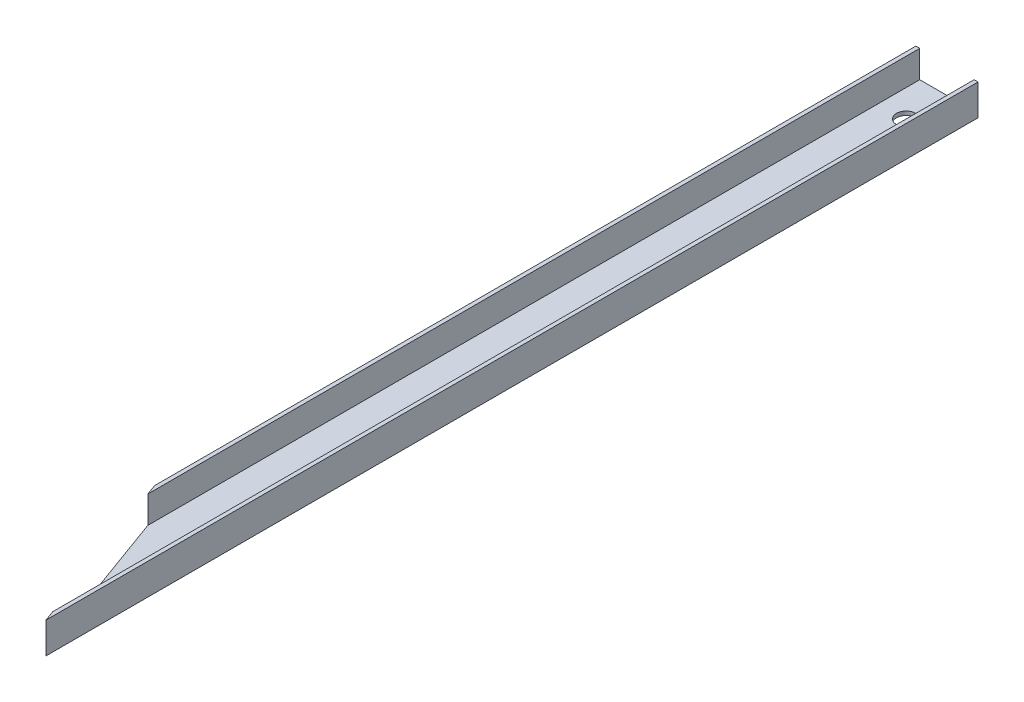
from build123d import *

# Parameters (mm, degrees)
BOSS_EXTRUDE1_DEPTH = 762
CUT_EXTRUDE1_DEPTH  = 763.846196818
CUT_EXTRUDE2_REACH  = 764.846
SKETCH3_R           = 7.9375


with BuildPart() as part:
    # Sketch1 → Boss-Extrude1 (new body)
    with BuildSketch(Plane.XY):
        Polygon((-22.225, -9.525), (-22.225, 12.7), (-25.4, 12.7), (-25.4, -12.7), (25.4, -12.7), (25.4, 12.7), (22.225, 12.7), (22.225, -9.525), align=None)
    extrude(amount=BOSS_EXTRUDE1_DEPTH)

    # Sketch2 → Cut-Extrude1 (cut, through all)
    with BuildSketch(Plane.XZ.offset(12.7)):
        Polygon((25.4, 762), (-25.4, 622.428147092), (-25.4, 762), align=None)
    extrude(amount=-CUT_EXTRUDE1_DEPTH, mode=Mode.SUBTRACT)

    # Sketch3 → Cut-Extrude2 (cut, up to next)
    with BuildSketch(Plane.XZ.offset(12.7), mode=Mode.PRIVATE) as cut_extrude2_sk1:
        with Locations((0, 33.3375)):
            Circle(SKETCH3_R)
    cut_extrude2_tool1 = extrude(cut_extrude2_sk1.sketch, amount=-CUT_EXTRUDE2_REACH, mode=Mode.PRIVATE) & part.part
    add(cut_extrude2_tool1.solids().sort_by_distance((0, -12.7, 33.3375))[0], mode=Mode.SUBTRACT)


solid = part.part
